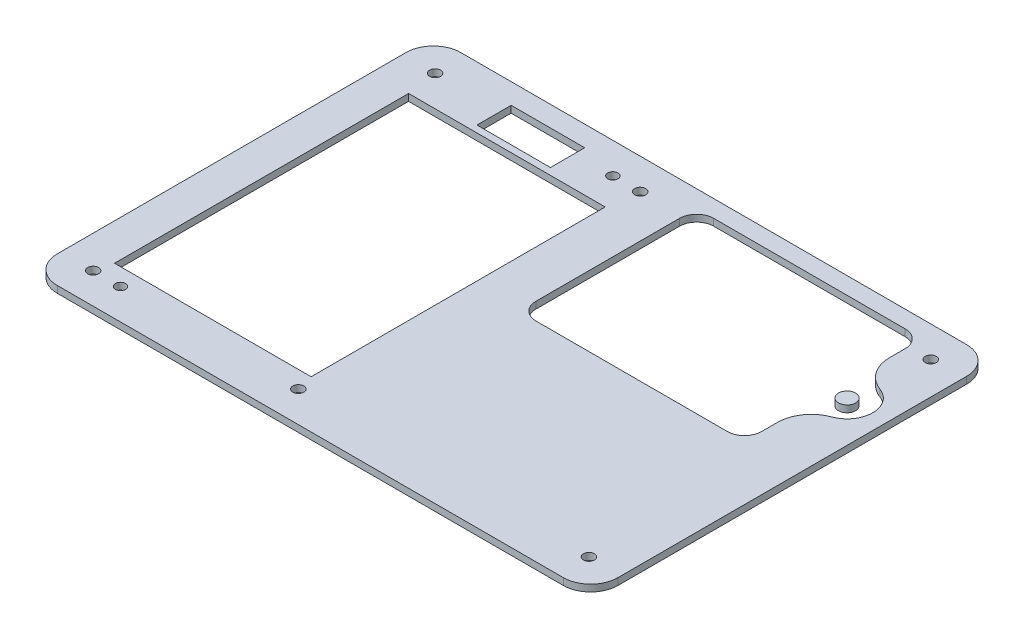
from build123d import *

# Parameters (mm, degrees)
BOSS_EXTRUDE1_DEPTH = 2
SKETCH2_W           = 57.5
SKETCH2_H           = 86
CUT_EXTRUDE1_DEPTH  = 102.039596199
SKETCH7_R           = 2.5
CUT_EXTRUDE6_DEPTH  = 102.039596199
SKETCH8_R           = 1.6
CUT_EXTRUDE7_DEPTH  = 102.039596199
SKETCH10_R          = 1.6
CUT_EXTRUDE9_DEPTH  = 102.039596199
SKETCH11_W          = 21.5
SKETCH11_H          = 10
CUT_EXTRUDE10_DEPTH = 102.039596199
SKETCH12_R          = 1.5
CUT_EXTRUDE11_DEPTH = 102.039596199


with BuildPart() as part:
    # Sketch1 → Boss-Extrude1 (new body)
    with BuildSketch(Plane(origin=(0, 0, 0), x_dir=(1, 0, 0), z_dir=(0, 1, 0))):
        with BuildLine():
            Line((-74, 59), (74, 59))
            ThreePointArc((74, 59), (79.656854249, 56.656854249), (82, 51))
            Line((82, 51), (82, -51))
            ThreePointArc((82, -51), (79.656854249, -56.656854249), (74, -59))
            Line((74, -59), (-74, -59))
            ThreePointArc((-74, -59), (-79.656854249, -56.656854249), (-82, -51))
            Line((-82, -51), (-82, 51))
            ThreePointArc((-82, 51), (-79.656854249, 56.656854249), (-74, 59))
        make_face()
    extrude(amount=BOSS_EXTRUDE1_DEPTH)

    # Sketch2 → Cut-Extrude1 (cut, through all)
    with BuildSketch(Plane(origin=(0, 2, 0), x_dir=(1, 0, 0), z_dir=(0, 1, 0))):
        with Locations((-42.5, -2)):
            Rectangle(SKETCH2_W, SKETCH2_H)
    extrude(amount=-CUT_EXTRUDE1_DEPTH, mode=Mode.SUBTRACT)

    # Sketch7 → Cut-Extrude6 (cut, through all)
    with BuildSketch(Plane(origin=(0, 2, 0), x_dir=(1, 0, 0), z_dir=(0, 1, 0))):
        with BuildLine():
            Line((0, 49), (0, 7))
            ThreePointArc((0, 7), (1.464466094, 3.464466094), (5, 2))
            Line((5, 2), (61, 2))
            ThreePointArc((61, 2), (64.535533906, 3.464466094), (66, 7))
            Line((66, 7), (66, 11.560717777))
            ThreePointArc((66, 11.560717777), (67.805925486, 17.292832819), (72.571428571, 20.954593333))
            ThreePointArc((72.571428571, 20.954593333), (77.5, 28), (72.571428571, 35.045406667))
            ThreePointArc((72.571428571, 35.045406667), (67.805925486, 38.707167181), (66, 44.439282223))
            Line((66, 44.439282223), (66, 49))
            ThreePointArc((66, 49), (64.535533906, 52.535533906), (61, 54))
            Line((61, 54), (5, 54))
            ThreePointArc((5, 54), (1.464466094, 52.535533906), (0, 49))
        make_face()
        with Locations(Location((70, 28, 0), (0, 0, 270))):
            Circle(SKETCH7_R, mode=Mode.SUBTRACT)
    extrude(amount=-CUT_EXTRUDE6_DEPTH, mode=Mode.SUBTRACT)


with BuildPart() as cut_extrude6_piece_1:
    # of the separate pieces the step leaves, piece 1, a body of its own (cut_extrude6_pieces)
    add(part.part.solids().sort_by_distance((-74, 0, -59))[0])

    # Sketch8 → Cut-Extrude7 (cut, through all)
    with BuildSketch(Plane(origin=(0, 2, 0), x_dir=(1, 0, 0), z_dir=(0, 1, 0))):
        with Locations(Location((72.5, -50, 0), (0, 0, 270))):
            Circle(SKETCH8_R)
        with Locations(Location((72.5, 50, 0), (0, 0, 270))):
            Circle(SKETCH8_R)
    cut_extrude7 = extrude(amount=-CUT_EXTRUDE7_DEPTH, mode=Mode.SUBTRACT)

    # Mirror1: Cut-Extrude7 across plane
    add(cut_extrude7.mirror(Plane(origin=(0, 0, 0), x_dir=(0, 0, 1), z_dir=(1, 0, 0))), mode=Mode.SUBTRACT)

    # Sketch10 → Cut-Extrude9 (cut, through all)
    with BuildSketch(Plane(origin=(0, 2, 0), x_dir=(1, 0, 0), z_dir=(0, 1, 0))):
        with Locations(Location((-12.5, -50, 0), (0, 0, 270))):
            Circle(SKETCH10_R)
        with Locations(Location((-12.5, 50, 0), (0, 0, 270))):
            Circle(SKETCH10_R)
    extrude(amount=-CUT_EXTRUDE9_DEPTH, mode=Mode.SUBTRACT)

    # Sketch11 → Cut-Extrude10 (cut, through all)
    with BuildSketch(Plane(origin=(0, 0, 0), x_dir=(-1, 0, 0), z_dir=(0, -1, 0))):
        with Locations((42.5, 48)):
            Rectangle(SKETCH11_W, SKETCH11_H)
    extrude(amount=-CUT_EXTRUDE10_DEPTH, mode=Mode.SUBTRACT)

    # Sketch12 → Cut-Extrude11 (cut, through all)
    with BuildSketch(Plane(origin=(0, 2, 0), x_dir=(1, 0, 0), z_dir=(0, 1, 0))):
        with Locations(Location((-64.5, -50, 0), (0, 0, 270))):
            Circle(SKETCH12_R)
        with Locations(Location((-20.5, 50, 0), (0, 0, 270))):
            Circle(SKETCH12_R)
    extrude(amount=-CUT_EXTRUDE11_DEPTH, mode=Mode.SUBTRACT)


with BuildPart() as cut_extrude6_piece_2:
    # of the separate pieces the step leaves, piece 2, a body of its own (cut_extrude6_pieces)
    add(part.part.solids().sort_by_distance((70, 0, -25.5))[0])


solid = Compound([cut_extrude6_piece_1.part, cut_extrude6_piece_2.part])
